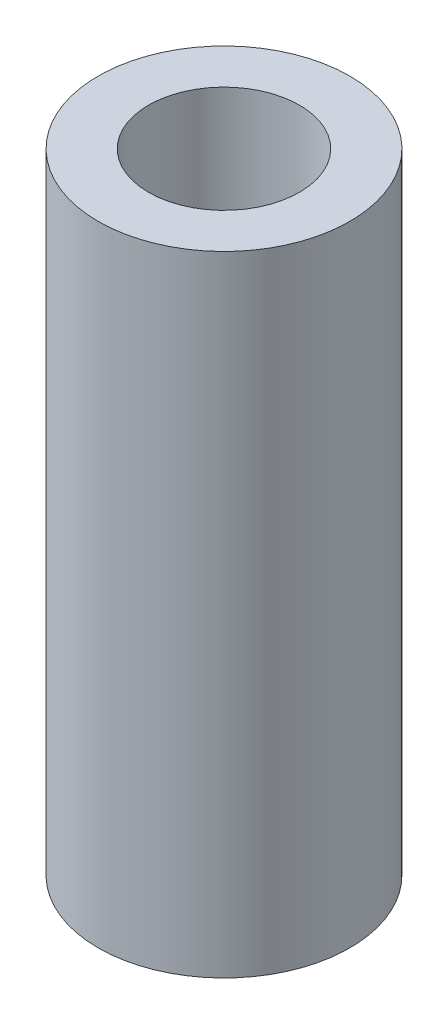
from build123d import *

# Parameters (mm, degrees)
SKETCH1_R           = 10
SKETCH1_R_2         = 6
BOSS_EXTRUDE1_DEPTH = 25
SCALE1_SCALE        = 0.245


with BuildPart() as part:
    # Sketch1 → Boss-Extrude1 (new, symmetric)
    with BuildSketch(Plane(origin=(0, 0, 0), x_dir=(1, 0, 0), z_dir=(0, 1, 0))):
        with Locations(Location((0, 0, 0), (0, 0, 270))):
            Circle(SKETCH1_R)
        with Locations(Location((0, 0, 0), (0, 0, 270))):
            Circle(SKETCH1_R_2, mode=Mode.SUBTRACT)
    extrude(amount=BOSS_EXTRUDE1_DEPTH, both=True)


with BuildPart() as part_1:
    # Scale1: scaled about (0, 0, 0)
    add(part.part.scale(SCALE1_SCALE))


solid = part_1.part
